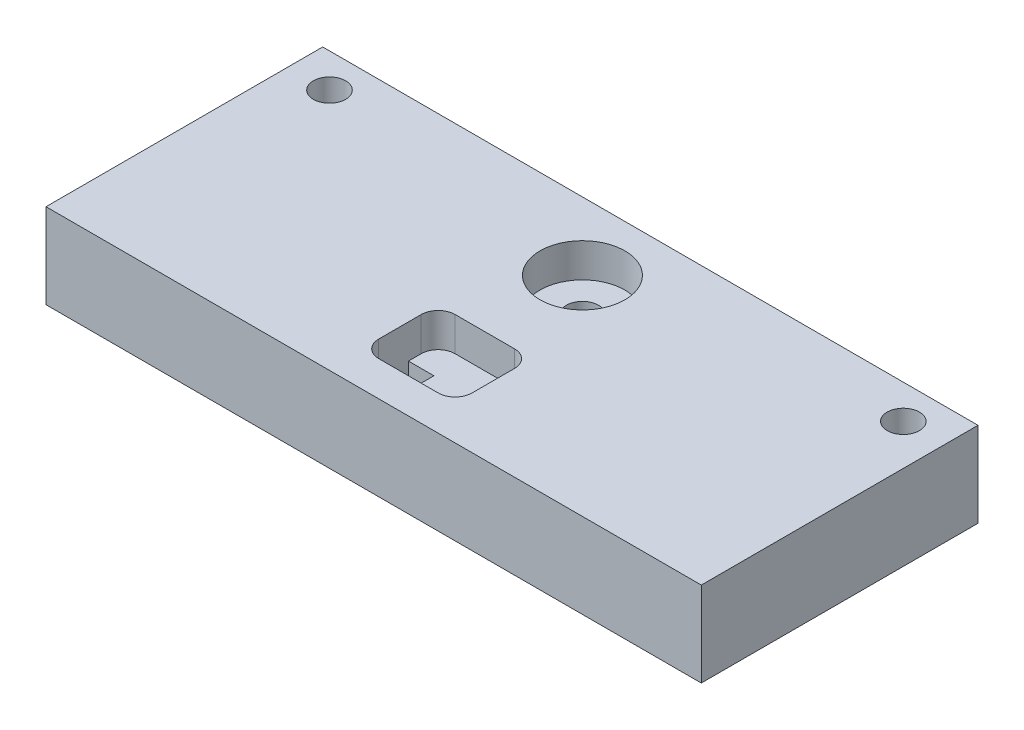
from build123d import *

# Parameters (mm, degrees)
SKETCH_1_W          = 10
SKETCH_1_H          = 16.3
SKETCH_1_R          = 2.5
EXTRUDE_1_DEPTH     = 2
SKETCH_3_W          = 10
SKETCH_3_H          = 16.3
SKETCH_3_R          = 0.95
SKETCH_3_W_2        = 1.5
SKETCH_3_H_2        = 1
EXTRUDE_2_DEPTH     = 3
SKETCH_4_W          = 14.3
SKETCH_4_H          = 16.3
EXTRUDE_3_DEPTH     = 5
SKETCH_5_R          = 0.95
CUT_EXTRUDE_1_DEPTH = 5
SKETCH_6_W          = 5
SKETCH_6_H          = 10
CUT_EXTRUDE_2_DEPTH = 3


with BuildPart() as part:
    # 草图1 → 凸台-拉伸1 (new body)
    with BuildSketch(Plane(origin=(0, 0, 0), x_dir=(1, 0, 0), z_dir=(0, 1, 0))):
        with Locations((0, 3.85)):
            Rectangle(SKETCH_1_W, SKETCH_1_H)
        with Locations(Location((0, 8, 0), (0, 0, 270))):
            Circle(SKETCH_1_R, mode=Mode.SUBTRACT)
        with BuildLine():
            Line((-1.75, 2.25), (1.75, 2.25))
            ThreePointArc((1.75, 2.25), (2.457106781, 1.957106781), (2.75, 1.25))
            Line((2.75, 1.25), (2.75, -1.25))
            ThreePointArc((2.75, -1.25), (2.457106781, -1.957106781), (1.75, -2.25))
            Line((1.75, -2.25), (-1.75, -2.25))
            ThreePointArc((-1.75, -2.25), (-2.457106781, -1.957106781), (-2.75, -1.25))
            Line((-2.75, -1.25), (-2.75, 1.25))
            ThreePointArc((-2.75, 1.25), (-2.457106781, 1.957106781), (-1.75, 2.25))
        make_face(mode=Mode.SUBTRACT)
    extrude(amount=EXTRUDE_1_DEPTH)

    # 草图3 → 凸台-拉伸2 (add)
    with BuildSketch(Plane.XZ):
        with Locations((0, -3.85)):
            Rectangle(SKETCH_3_W, SKETCH_3_H)
        with Locations(Location((0, -8, 0), (0, 0, 270))):
            Circle(SKETCH_3_R, mode=Mode.SUBTRACT)
        with Locations((-2, 0)):
            Rectangle(SKETCH_3_W_2, SKETCH_3_H_2, mode=Mode.SUBTRACT)
        with Locations((2, 0)):
            Rectangle(SKETCH_3_W_2, SKETCH_3_H_2, mode=Mode.SUBTRACT)
    extrude(amount=EXTRUDE_2_DEPTH)

    # 草图4 → 凸台-拉伸3 (add)
    with BuildSketch(Plane.XZ.offset(3)):
        with Locations((12.15, -3.85)):
            Rectangle(SKETCH_4_W, SKETCH_4_H)
        with Locations((-12.15, -3.85)):
            Rectangle(SKETCH_4_W, SKETCH_4_H)
    extrude(amount=-EXTRUDE_3_DEPTH)

    # 草图5 → 切除-拉伸1 (cut)
    with BuildSketch(Plane(origin=(0, 2, 0), x_dir=(1, 0, 0), z_dir=(0, 1, 0))):
        with Locations(Location((-16.9, 10, 0), (0, 0, 270))):
            Circle(SKETCH_5_R)
        with Locations(Location((16.9, 10, 0), (0, 0, 270))):
            Circle(SKETCH_5_R)
    extrude(amount=-CUT_EXTRUDE_1_DEPTH, mode=Mode.SUBTRACT)

    # 草图6 → 切除-拉伸2 (cut)
    with BuildSketch(Plane.XZ.offset(3)):
        with Locations((-8.5, -2.7)):
            Rectangle(SKETCH_6_W, SKETCH_6_H)
        with Locations((8.5, -2.7)):
            Rectangle(SKETCH_6_W, SKETCH_6_H)
    extrude(amount=-CUT_EXTRUDE_2_DEPTH, mode=Mode.SUBTRACT)


solid = part.part
